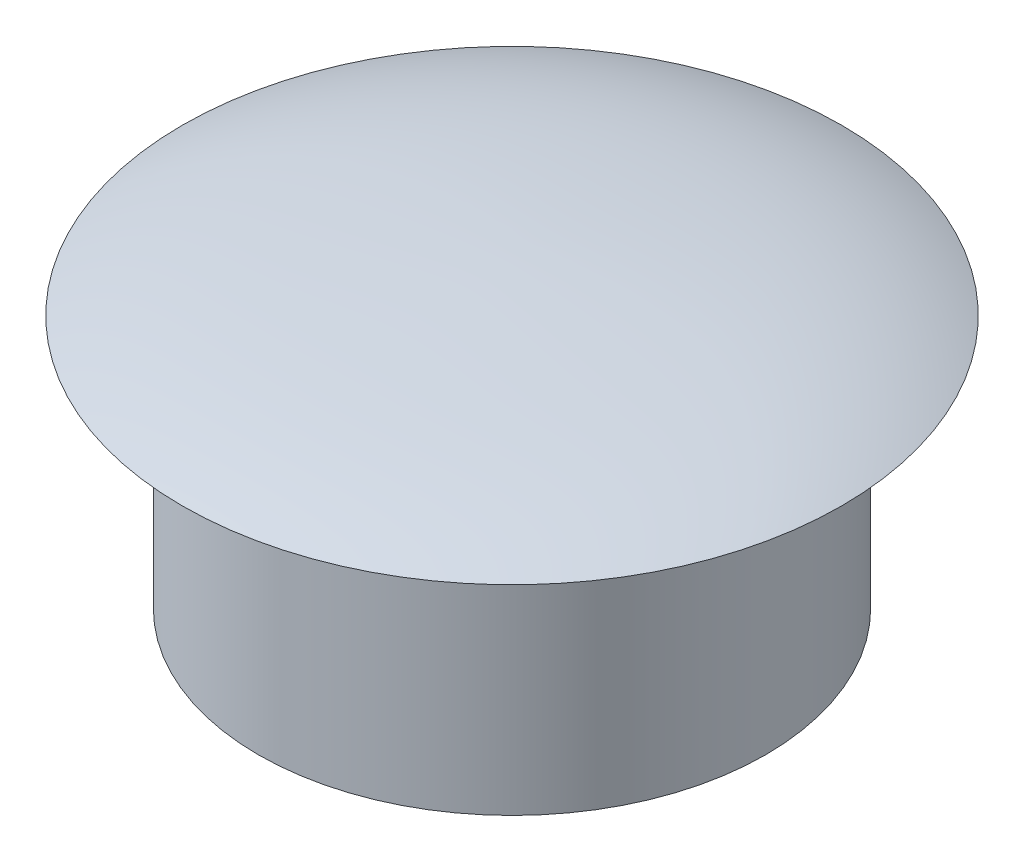
from build123d import *


with BuildPart() as part:
    # Sketch1 → Revolve1 (revolve)
    with BuildSketch(Plane.XY):
        with BuildLine():
            Line((-4.247747681, 9.575128247), (-5.247747681, 9.575128247))
            Line((-5.247747681, 9.575128247), (-5.247747681, 14.575128247))
            Line((-5.247747681, 14.575128247), (-6.747747681, 14.575128247))
            add(Edge.make_bspline(
                [(-6.747747681, 14.575128247), (-5.656402444, 15.055999891), (-3.605305926, 15.388425446), (-1.043314706, 15.512478323), (-0.247747681, 15.512478323)],
                knots=[0, 0, 0, 0, 0.533518158, 1, 1, 1, 1], degree=3))
            Line((-0.247747681, 15.512478323), (-0.247747681, 14.575128247))
            Line((-0.247747681, 14.575128247), (-4.247747681, 14.575128247))
            Line((-4.247747681, 14.575128247), (-4.247747681, 9.575128247))
        make_face()
    revolve(axis=Axis((-0.247747681, 15.512478323, 0), (0, -1, 0)))


solid = part.part
